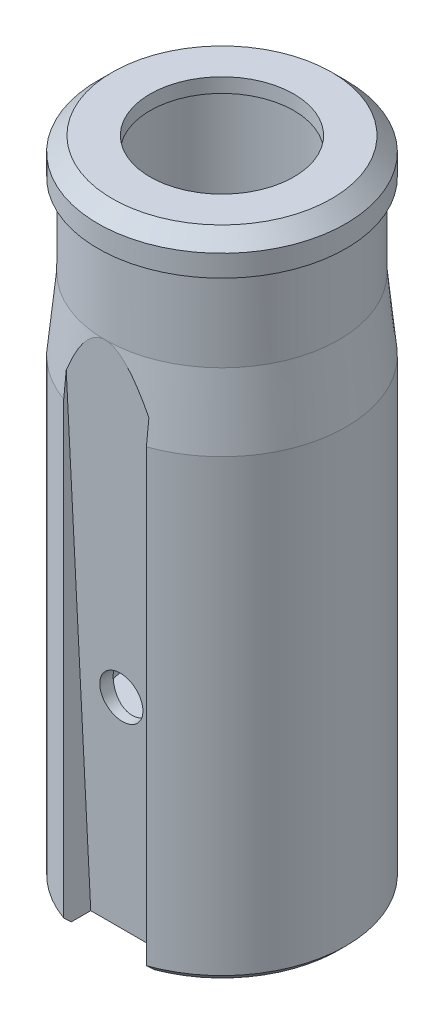
from build123d import *

# Parameters (mm, degrees)
LOCATING_HOLE_REACH      = 21.386
LOCATING_HOLE_END_RADIUS = 2.5
LOCATINGHOLES_R          = 0.6


with BuildPart() as part:
    # MainBodyS → MAIN BODY (revolve)
    with BuildSketch(Plane.XY, mode=Mode.PRIVATE) as main_body_sk:
        Polygon((3.45, 0.2), (3.45, 12.7), (3.25, 14.7), (3.25, 17), (3.45, 17), (3.45, 17.6), (3.05, 18), (2, 18), (2, 17.6), (2.5, 17.6), (2.5, 4), (1.1, 4), (1.1, 0), (3.25, 0), align=None)
    revolve(main_body_sk.sketch.rotate(Axis((0, 0, 0), (0, 1, 0)), 90), axis=Axis((0, 0, 0), (0, 1, 0)))

    # LoftedSlotEndS → LOFTED SLOT section 0
    with BuildSketch(Plane(origin=(0, 14.7, 0), x_dir=(-1, 0, 0), z_dir=(0, -1, 0))):
        with BuildLine():
            Line((-1.15, 3.75), (1.15, 3.75))
            Line((1.15, 3.75), (1.15, 3.25))
            Line((1.15, 3.25), (-1.15, 3.25))
            Line((-1.15, 3.25), (-1.15, 3.75))
        make_face()
    # LoftedSlotStartS → LOFTED SLOT section 1
    with BuildSketch(Plane(origin=(0, 0, 0), x_dir=(-1, 0, 0), z_dir=(0, -1, 0))):
        with BuildLine():
            Line((-1.15, 3.45), (1.15, 3.45))
            Line((1.15, 3.45), (1.15, 2.5))
            Line((1.15, 2.5), (-1.15, 2.5))
            Line((-1.15, 2.5), (-1.15, 3.45))
        make_face()
    lofted_slot = loft(mode=Mode.SUBTRACT)

    # LS HM: LOFTED SLOT across plane
    add(lofted_slot.mirror(Plane.XY), mode=Mode.SUBTRACT)

    # LOCATING HOLE: up to this cylinder (the profile starts outside it)
    locating_hole_end = Plane(origin=(0, 5.864986, 0), z_dir=(0, -1, 0)) * Cylinder(LOCATING_HOLE_END_RADIUS, 48.772, mode=Mode.PRIVATE)
    # LocatingHoleS → LOCATING HOLE (cut, up to the surface)
    with BuildSketch(Plane(origin=(0, -0.127219857, 2.493509191), x_dir=(1, 0, 0), z_dir=(0, -0.050954132371911015, 0.9987009944894546)), mode=Mode.PRIVATE) as locating_hole_sk1:
        with Locations(Location((0, 6, 0), (0, 0, 270))):
            Circle(LOCATINGHOLES_R)
    locating_hole_tool1 = extrude(locating_hole_sk1.sketch, amount=-LOCATING_HOLE_REACH, mode=Mode.PRIVATE) - locating_hole_end
    add(locating_hole_tool1.solids().sort_by_distance((0, 5.864986, 2.799234))[0], mode=Mode.SUBTRACT)


solid = part.part
